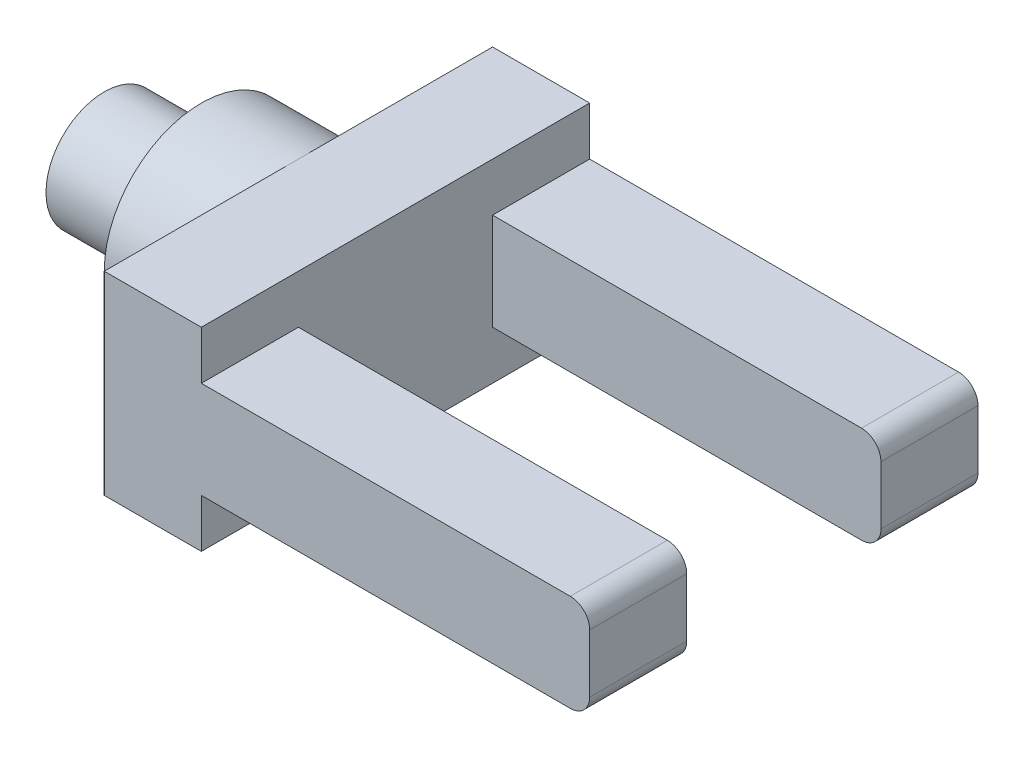
from build123d import *

# Parameters (mm, degrees)
SKETCH1_R           = 10
BOSS_EXTRUDE1_DEPTH = 20
SKETCH2_OUTSIDE_W   = 28.928
SKETCH2_OUTSIDE_H   = 28.928
SKETCH2_OUTSIDE_R   = 6
CUT_EXTRUDE1_DEPTH  = 10
SKETCH4_W           = 40
SKETCH4_H           = 20
BOSS_EXTRUDE2_DEPTH = 10
SKETCH6_W           = 10
SKETCH6_H           = 10
BOSS_EXTRUDE3_DEPTH = 40
SKETCH7_W           = 10
SKETCH7_H           = 10
BOSS_EXTRUDE4_DEPTH = 40
FILLET1_R           = 2


with BuildPart() as part:
    # Sketch1 → Boss-Extrude1 (new body)
    with BuildSketch(Plane(origin=(0, 0, 0), x_dir=(0, 0, -1), z_dir=(1, 0, 0))):
        Circle(SKETCH1_R)
    extrude(amount=BOSS_EXTRUDE1_DEPTH)

    # Sketch2 outside → Cut-Extrude1 (cut)
    with BuildSketch(Plane.ZY):
        Rectangle(SKETCH2_OUTSIDE_W, SKETCH2_OUTSIDE_H)
        Circle(SKETCH2_OUTSIDE_R, mode=Mode.SUBTRACT)
    extrude(amount=-CUT_EXTRUDE1_DEPTH, mode=Mode.SUBTRACT)

    # Sketch4 → Boss-Extrude2 (add)
    with BuildSketch(Plane(origin=(20, 0, 0), x_dir=(0, 0, -1), z_dir=(1, 0, 0))):
        Rectangle(SKETCH4_W, SKETCH4_H)
    extrude(amount=BOSS_EXTRUDE2_DEPTH)

    # Sketch6 → Boss-Extrude3 (add)
    with BuildSketch(Plane(origin=(30, 0, 0), x_dir=(0, 0, -1), z_dir=(1, 0, 0))):
        with Locations((-15, 0)):
            Rectangle(SKETCH6_W, SKETCH6_H)
    extrude(amount=BOSS_EXTRUDE3_DEPTH)

    # Sketch7 → Boss-Extrude4 (add)
    with BuildSketch(Plane(origin=(30, 0, 0), x_dir=(0, 0, -1), z_dir=(1, 0, 0))):
        with Locations((15, 0)):
            Rectangle(SKETCH7_W, SKETCH7_H)
    extrude(amount=BOSS_EXTRUDE4_DEPTH)

    # Fillet1
    fillet1_edges = [part.edges().sort_by_distance(p)[0] for p in [
        (70, -5, -15),
        (70, 5, -15),
        (70, -5, 15),
        (70, 5, 15),
    ]]
    fillet(fillet1_edges, radius=FILLET1_R)


solid = part.part
